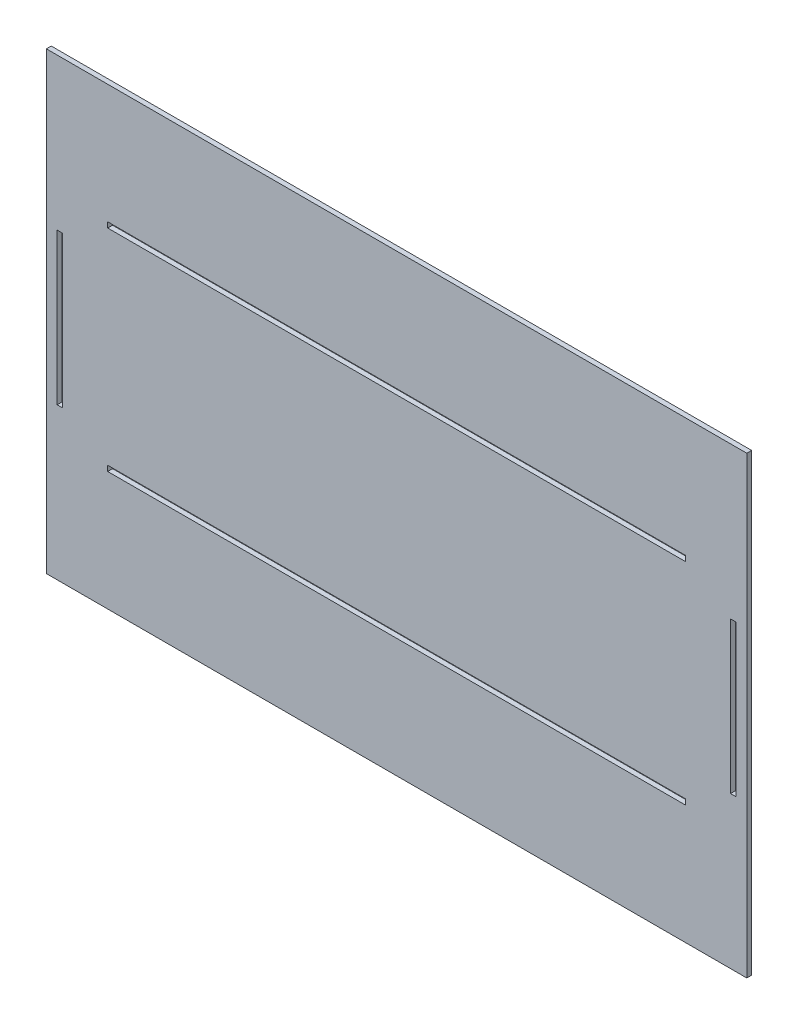
from build123d import *

# Parameters (mm, degrees)
SKETCH1_W           = 328.60742
SKETCH1_H           = 111.6203
SKETCH1_W_2         = 271.033754468
SKETCH1_H_2         = 2.54
SKETCH1_W_3         = 2.54
SKETCH1_H_3         = 70.9803
BOSS_EXTRUDE1_DEPTH = 2.286
SKETCH2_W           = 328.60742
SKETCH2_H           = 50.8
BOSS_EXTRUDE2_DEPTH = 2.286


with BuildPart() as part:
    # Sketch1 → Boss-Extrude1 (new body)
    with BuildSketch(Plane.XY):
        with Locations((156.68371, 48.19015)):
            Rectangle(SKETCH1_W, SKETCH1_H)
        with Locations((156.68371, 97.6503)):
            Rectangle(SKETCH1_W_2, SKETCH1_H_2, mode=Mode.SUBTRACT)
        with Locations((-1.27, 48.19015)):
            Rectangle(SKETCH1_W_3, SKETCH1_H_3, mode=Mode.SUBTRACT)
        with Locations((314.63742, 48.19015)):
            Rectangle(SKETCH1_W_3, SKETCH1_H_3, mode=Mode.SUBTRACT)
        with Locations((156.68371, -1.27)):
            Rectangle(SKETCH1_W_2, SKETCH1_H_2, mode=Mode.SUBTRACT)
    extrude(amount=BOSS_EXTRUDE1_DEPTH)

    # Sketch2 → Boss-Extrude2 (add, through all)
    with BuildSketch(Plane.XY.offset(2.286)):
        with Locations((156.68371, 129.4003)):
            Rectangle(SKETCH2_W, SKETCH2_H)
        with Locations((156.68371, -33.02)):
            Rectangle(SKETCH2_W, SKETCH2_H)
    extrude(amount=-BOSS_EXTRUDE2_DEPTH)


solid = part.part
